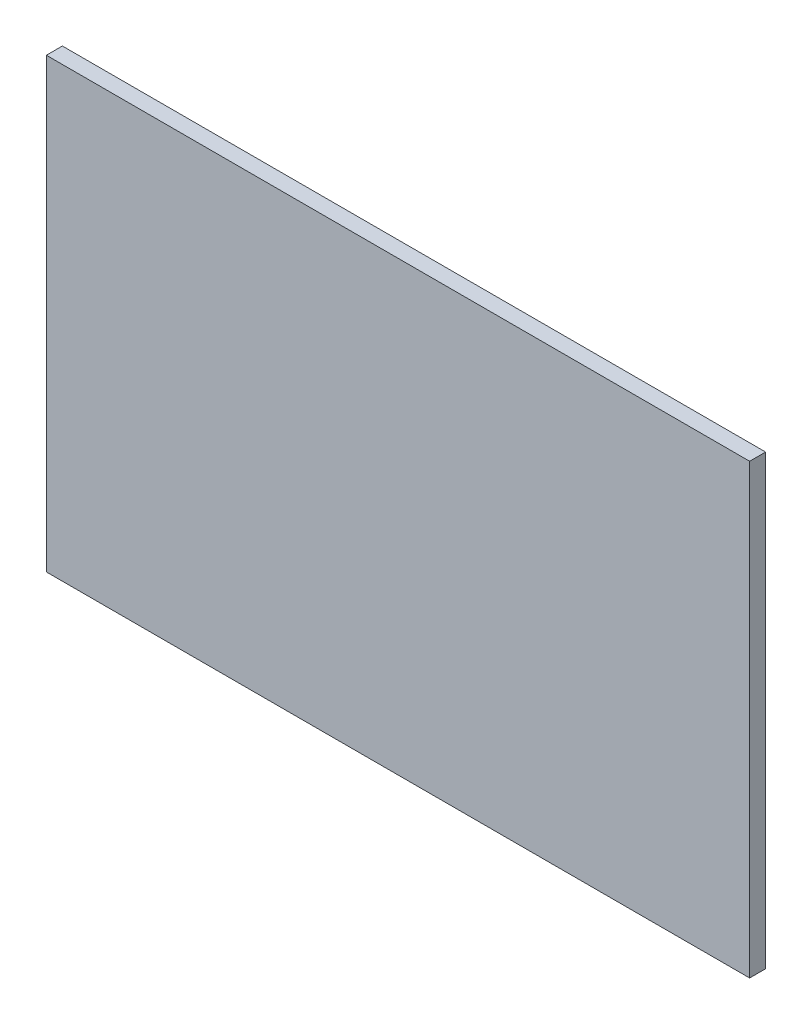
from build123d import *

# Parameters (mm, degrees)
SKETCH1_W           = 220
SKETCH1_H           = 140
BOSS_EXTRUDE1_DEPTH = 5


with BuildPart() as part:
    # Sketch1 → Boss-Extrude1 (new body)
    with BuildSketch(Plane.XY):
        Rectangle(SKETCH1_W, SKETCH1_H)
    extrude(amount=BOSS_EXTRUDE1_DEPTH)


solid = part.part
